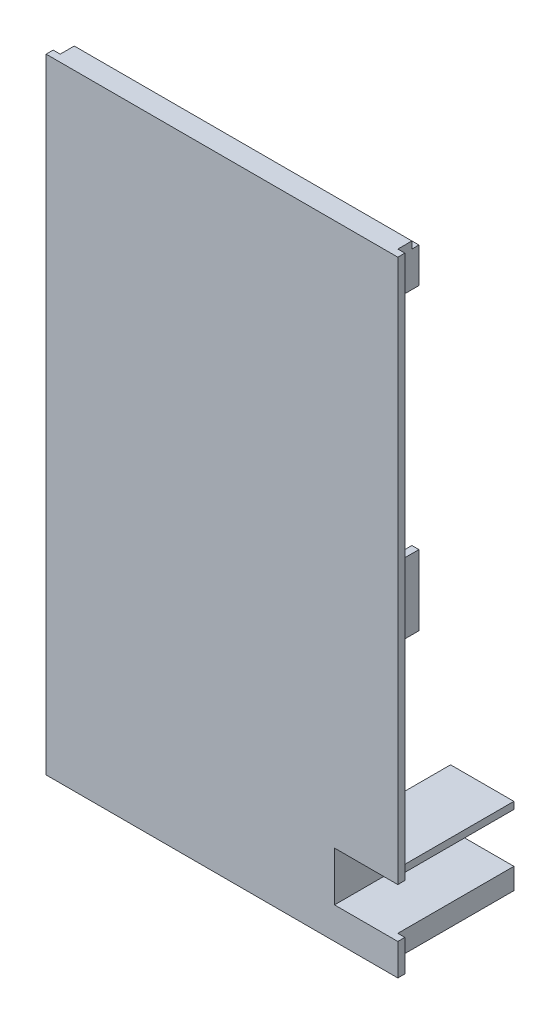
from build123d import *

# Parameters (mm, degrees)
SKETCH1_W           = 100
SKETCH1_H           = 177.5
BOSS_EXTRUDE1_DEPTH = 2
SKETCH3_W           = 2
SKETCH3_H           = 20
BOSS_EXTRUDE2_DEPTH = 6
SKETCH4_W           = 96
SKETCH4_H           = 2
BOSS_EXTRUDE3_DEPTH = 4
BOSS_EXTRUDE5_DEPTH = 33
SKETCH7_W           = 18
SKETCH7_H           = 14
CUT_EXTRUDE2_DEPTH  = 207.386167172


with BuildPart() as part:
    # Sketch1 → Boss-Extrude1 (new body)
    with BuildSketch(Plane.XY):
        with Locations((50, 88.75)):
            Rectangle(SKETCH1_W, SKETCH1_H)
    extrude(amount=BOSS_EXTRUDE1_DEPTH)

    # Sketch3 → Boss-Extrude2 (add)
    with BuildSketch(Plane(origin=(0, 0, 0), x_dir=(-1, 0, 0), z_dir=(0, 0, -1))):
        Polygon((-98, 175.5), (-88, 175.5), (-88, 173.5), (-96, 173.5), (-96, 165.5), (-98, 165.5), align=None)
        Polygon((-12, 175.5), (-2, 175.5), (-2, 165.5), (-4, 165.5), (-4, 173.5), (-12, 173.5), align=None)
        Polygon((-2, 3), (-12, 3), (-12, 5), (-4, 5), (-4, 13), (-2, 13), align=None)
        with Locations((-97, 90.5)):
            Rectangle(SKETCH3_W, SKETCH3_H)
        with Locations((-3, 90.5)):
            Rectangle(SKETCH3_W, SKETCH3_H)
    extrude(amount=BOSS_EXTRUDE2_DEPTH)

    # Sketch4 → Boss-Extrude3 (add)
    with BuildSketch(Plane(origin=(0, 0, 0), x_dir=(-1, 0, 0), z_dir=(0, 0, -1))):
        with Locations((-50, 176.5)):
            Rectangle(SKETCH4_W, SKETCH4_H)
    extrude(amount=BOSS_EXTRUDE3_DEPTH)

    # Sketch5 → Boss-Extrude5 (add)
    with BuildSketch(Plane(origin=(0, 0, 0), x_dir=(-1, 0, 0), z_dir=(0, 0, -1))):
        Polygon((-98, 3), (-80, 3), (-80, 25), (-98, 25), (-98, 23), (-82, 23), (-82, 9), (-98, 9), align=None)
    extrude(amount=BOSS_EXTRUDE5_DEPTH)

    # Sketch7 → Cut-Extrude2 (cut, through all)
    with BuildSketch(Plane(origin=(0, 0, 0), x_dir=(-1, 0, 0), z_dir=(0, 0, -1))):
        with Locations((-91, 16)):
            Rectangle(SKETCH7_W, SKETCH7_H)
    extrude(amount=-CUT_EXTRUDE2_DEPTH, mode=Mode.SUBTRACT)


solid = part.part
